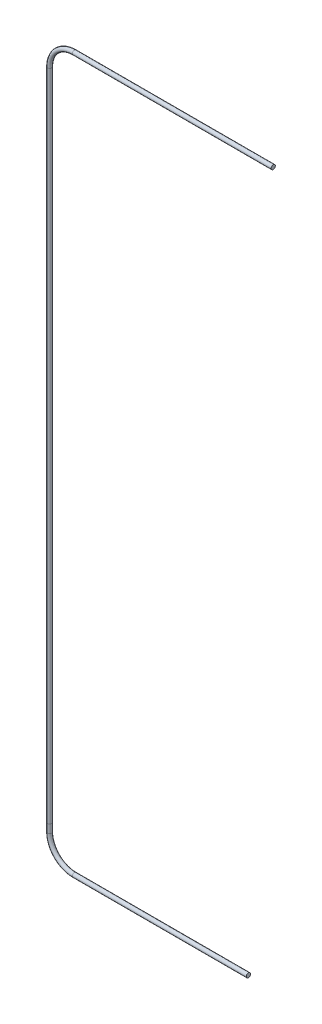
from build123d import *

# Parameters (mm, degrees)
SWEEP1_PROFILE_R = 6.35


with BuildPart() as part:
    # Sweep1: sweep along a path in Sketch1
    with BuildLine(Plane.XY) as sweep1_path:
        Line((675, 2050), (75, 2050))
        ThreePointArc((75, 2050), (21.966991411, 2028.033008589), (0, 1975))
        Line((0, 1975), (0, 0))
        Line((0, 0), (0, -25))
        ThreePointArc((0, -25), (21.966991411, -78.033008589), (75, -100))
        Line((75, -100), (600, -100))
    # Sweep1 profile (on start of the path) → Sweep1 (sweep)
    with BuildSketch(Plane(origin=(675, 2050, 0), x_dir=(0, 0, -1), z_dir=(-1, 0, 0))):
        Circle(SWEEP1_PROFILE_R)
    sweep(path=sweep1_path.line)


solid = part.part
